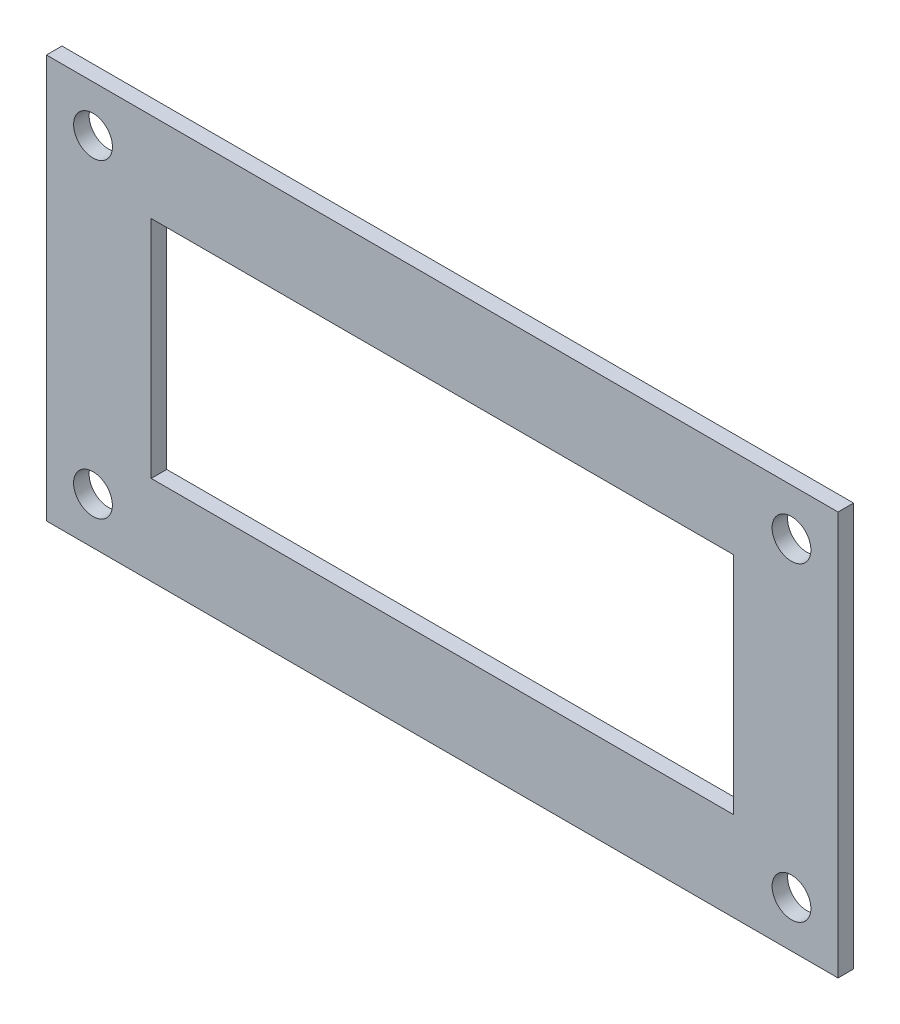
from build123d import *

# Parameters (mm, degrees)
SKETCH1_W           = 102
SKETCH1_H           = 52
SKETCH1_R           = 2.5
SKETCH1_W_2         = 75
SKETCH1_H_2         = 29
BOSS_EXTRUDE2_DEPTH = 2


with BuildPart() as part:
    # Sketch1 → Boss-Extrude2 (new body)
    with BuildSketch(Plane.XY):
        Rectangle(SKETCH1_W, SKETCH1_H)
        with Locations((-45, 20)):
            Circle(SKETCH1_R, mode=Mode.SUBTRACT)
        with Locations(Location((45, 20, 0), (0, 0, 180))):
            Circle(SKETCH1_R, mode=Mode.SUBTRACT)
        with Locations((45, -20)):
            Circle(SKETCH1_R, mode=Mode.SUBTRACT)
        with Locations(Location((-45, -20, 0), (0, 0, 180))):
            Circle(SKETCH1_R, mode=Mode.SUBTRACT)
        Rectangle(SKETCH1_W_2, SKETCH1_H_2, mode=Mode.SUBTRACT)
    extrude(amount=BOSS_EXTRUDE2_DEPTH)


solid = part.part
